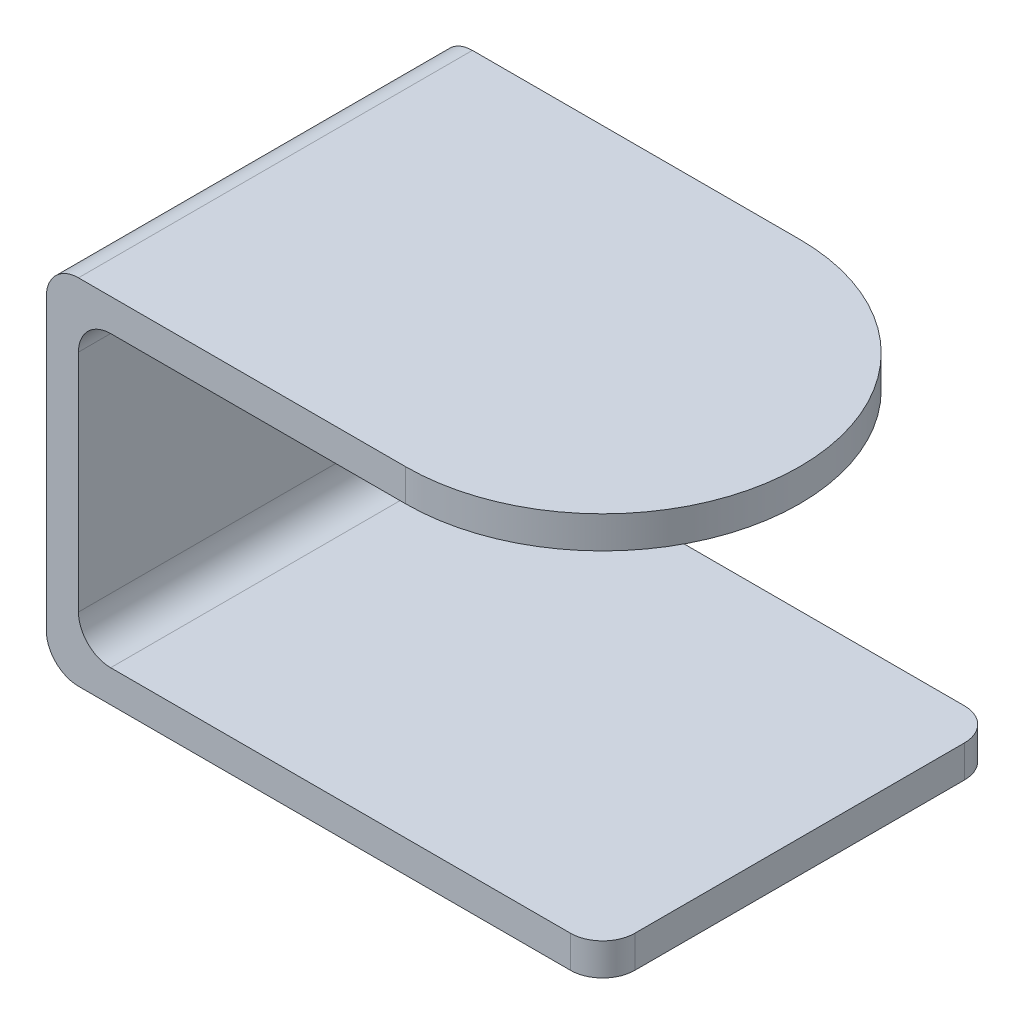
from build123d import *

# Parameters (mm, degrees)
BOSS_EXTRUDE2_DEPTH = 12.25
FILLET1_RADIUS      = 6.125
FILLET1_LENGTH      = 1
FILLET3_R           = 1


with BuildPart() as part:
    # Sketch1 → Boss-Extrude2 (new body)
    with BuildSketch(Plane.XY):
        Polygon((0, 0), (-17.3, 0), (-17.3, 11), (0, 11), (0, 10), (-16.3, 10), (-16.3, 1), (0, 1), align=None)
    extrude(amount=BOSS_EXTRUDE2_DEPTH)

    # Fillet1: full round fillet: the end face becomes a half cylinder, R = half its width
    fillet1_face = Plane((0, 10.5, 6.125), x_dir=(0, -1, 0), z_dir=(1, 0, 0))  # on the end face: x along it, z out of the body
    fillet1_slab = fillet1_face.offset(-FILLET1_RADIUS / 2) * Box(FILLET1_LENGTH, 2 * FILLET1_RADIUS, FILLET1_RADIUS, mode=Mode.PRIVATE)  # the body's end, R deep
    fillet1_round = Plane((-6.125, 10.5, 6.125), x_dir=(1, 0, 0), z_dir=(0, -1, 0)) * Cylinder(FILLET1_RADIUS, FILLET1_LENGTH, mode=Mode.PRIVATE)  # its axis R under the face
    add(fillet1_slab - fillet1_round, mode=Mode.SUBTRACT)

    # Fillet3
    fillet3_edges = [part.edges().sort_by_distance(p)[0] for p in [
        (0, 0.5, 0),
        (-17.3, 0, 6.125),
        (-17.3, 11, 6.125),
        (-16.3, 10, 6.125),
        (-16.3, 1, 6.125),
        (0, 0.5, 12.25),
    ]]
    fillet(fillet3_edges, radius=FILLET3_R)


solid = part.part
